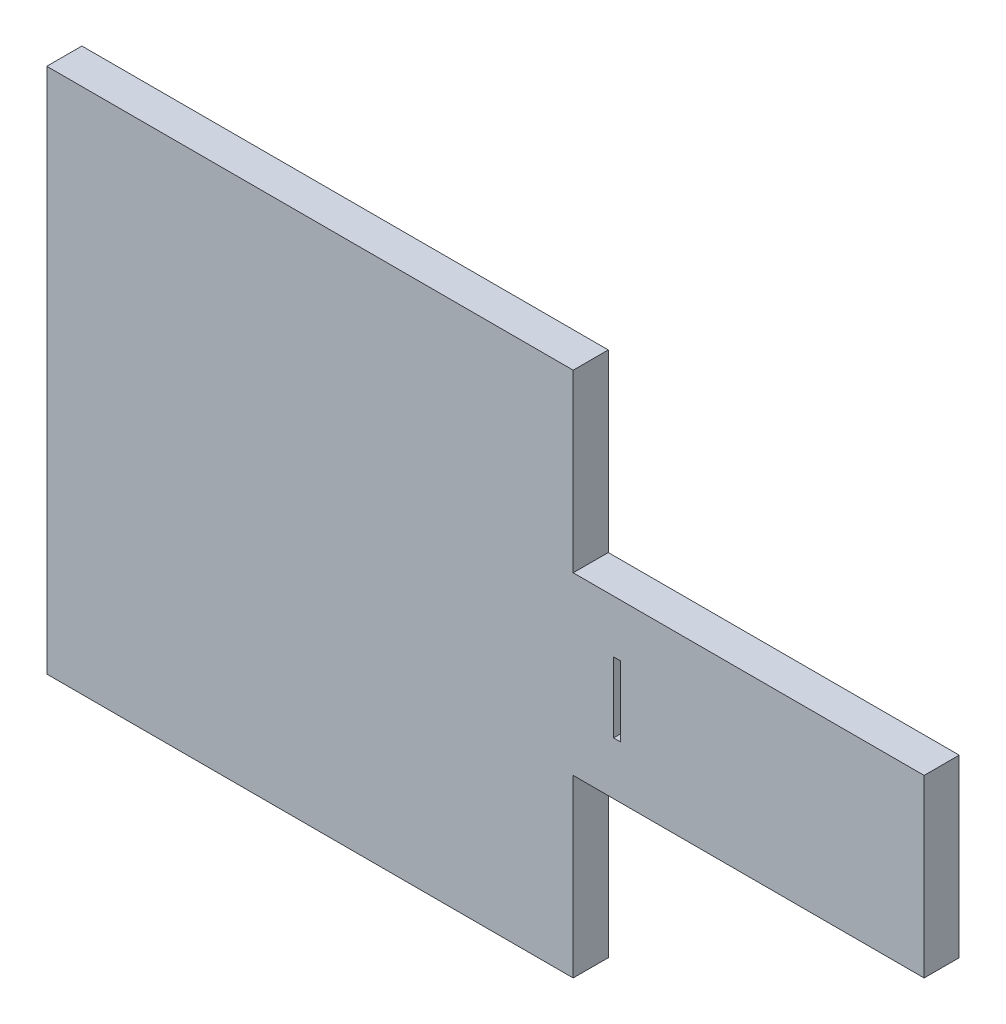
from build123d import *

# Parameters (mm, degrees)
SKETCH1_W           = 0.508
SKETCH1_H           = 5.08
BOSS_EXTRUDE1_DEPTH = 2.54


with BuildPart() as part:
    # Sketch1 → Boss-Extrude1 (new body)
    with BuildSketch(Plane.XY):
        Polygon((-6.35, 12.7), (-6.35, 25.4), (-44.45, 25.4), (-44.45, -12.7), (-6.35, -12.7), (-6.35, 0), (19.05, 0), (19.05, 12.7), align=None)
        with Locations((-3.175, 6.35)):
            Rectangle(SKETCH1_W, SKETCH1_H, mode=Mode.SUBTRACT)
    extrude(amount=BOSS_EXTRUDE1_DEPTH)


solid = part.part
